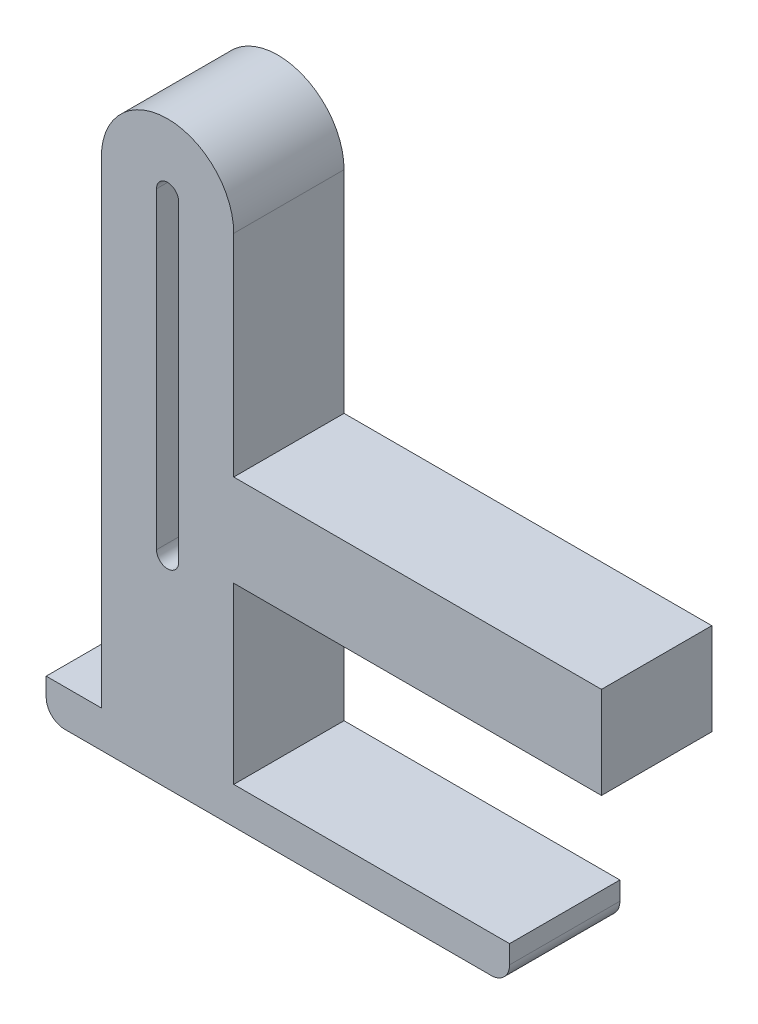
from build123d import *

# Parameters (mm, degrees)
BOSS_EXTRUDE1_DEPTH  = 6
SKETCH2_W            = 6
SKETCH2_H            = 5
BOSS_EXTRUDE2_DEPTH  = 20
EXTRUDE_1_DEPTH      = 15
EXTRUDE_1_DEPTH_BACK = 10.2
SKETCH_2_W           = 6
SKETCH_2_H           = 2
FILLET_3_R           = 1


with BuildPart() as part:
    # Sketch1 → Boss-Extrude1 (new body)
    with BuildSketch(Plane.XY):
        with BuildLine():
            Line((-3.6, 0), (-3.6, 17))
            ThreePointArc((-3.6, 17), (0, 20.6), (3.6, 17))
            Line((3.6, 17), (3.6, 0))
            Line((3.6, 0), (3.6, -10.95432829))
            Line((3.6, -10.95432829), (-3.6, -10.95432829))
            Line((-3.6, -10.95432829), (-3.6, 0))
        make_face()
        with BuildLine():
            Line((-0.6, 0), (-0.6, 17))
            ThreePointArc((-0.6, 17), (0, 17.6), (0.6, 17))
            Line((0.6, 17), (0.6, 0))
            ThreePointArc((0.6, 0), (0, -0.6), (-0.6, 0))
        make_face(mode=Mode.SUBTRACT)
    extrude(amount=BOSS_EXTRUDE1_DEPTH)

    # Sketch2 → Boss-Extrude2 (add)
    with BuildSketch(Plane(origin=(3.6, 0, 0), x_dir=(0, 0, -1), z_dir=(1, 0, 0))):
        with Locations((-3, 3.022835855)):
            Rectangle(SKETCH2_W, SKETCH2_H)
    extrude(amount=BOSS_EXTRUDE2_DEPTH)

    # Эскиз2 → Бобышка-Вытянуть1 (add, two sides: drawn at the far end of the back side and taken through both)
    with BuildSketch(Plane(origin=(3.6, 0, 0), x_dir=(0, 0, -1), z_dir=(1, 0, 0)).offset(-EXTRUDE_1_DEPTH_BACK)):
        with Locations((-3, -9.95432829)):
            Rectangle(SKETCH_2_W, SKETCH_2_H)
    extrude(amount=EXTRUDE_1_DEPTH + EXTRUDE_1_DEPTH_BACK)

    # Скругление3
    fillet_3_edges = [part.edges().sort_by_distance(p)[0] for p in [
        (-6.6, -10.95432829, 3),
        (18.6, -10.95432829, 3),
    ]]
    fillet(fillet_3_edges, radius=FILLET_3_R)


solid = part.part
